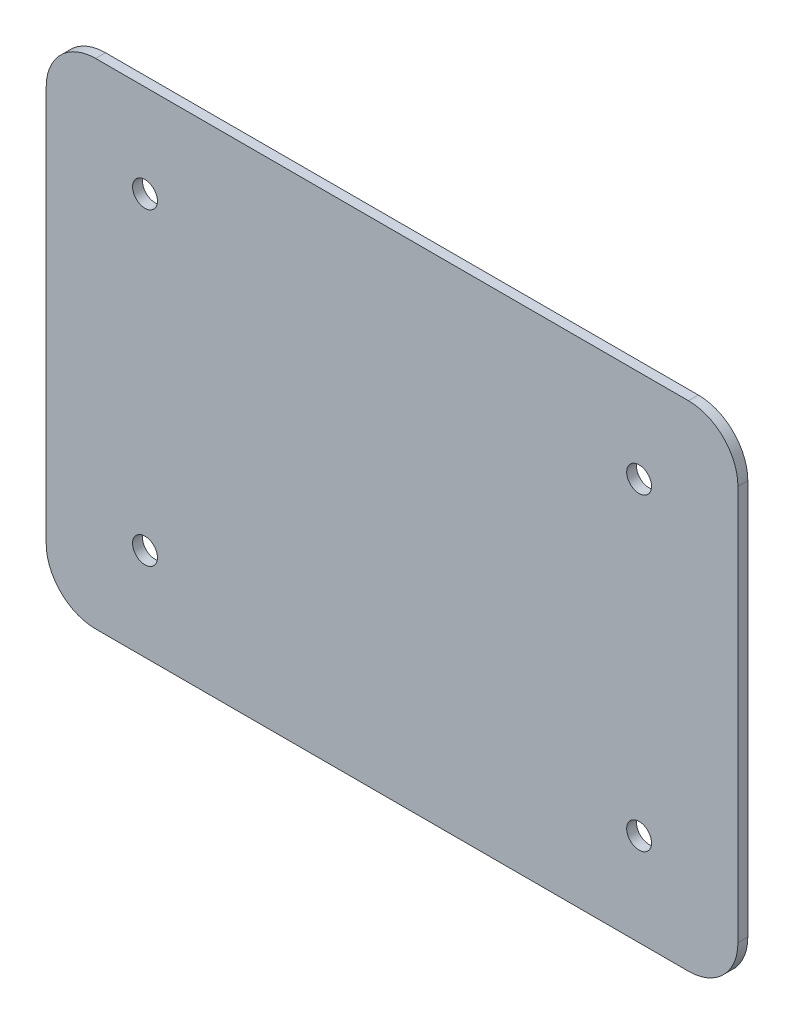
from build123d import *

# Parameters (mm, degrees)
SKETCH1_W                                  = 140
SKETCH1_H                                  = 100
BOSS_EXTRUDE1_DEPTH                        = 2
CUT_EXTRUDE2_REACH                         = 88.046
SKETCH2_R                                  = 2.515
FILLET1_R                                  = 10
MIRROR1_AT_THE_SECOND_PLANE_COPY_1_REACH   = 88.046
MIRROR1_AT_THE_SECOND_PLANE_COPY_1_SKETC_R = 2.515


with BuildPart() as part:
    # Sketch1 → Boss-Extrude1 (new body)
    with BuildSketch(Plane.XY):
        Rectangle(SKETCH1_W, SKETCH1_H)
    extrude(amount=BOSS_EXTRUDE1_DEPTH)

    # Sketch2 → Cut-Extrude2 (cut, up to next)
    with BuildSketch(Plane.XY, mode=Mode.PRIVATE) as cut_extrude2_sk1:
        with Locations((-50, 31.25)):
            Circle(SKETCH2_R)
    cut_extrude2_tool1 = extrude(cut_extrude2_sk1.sketch, amount=CUT_EXTRUDE2_REACH, mode=Mode.PRIVATE) & part.part
    cut_extrude2 = cut_extrude2_tool1.solids().sort_by_distance((-50, 31.25, 0))[0]
    add(cut_extrude2, mode=Mode.SUBTRACT)

    # Fillet1
    fillet1_edges = [part.edges().sort_by_distance(p)[0] for p in [
        (70, -50, 1),
        (70, 50, 1),
        (-70, -50, 1),
        (-70, 50, 1),
    ]]
    fillet(fillet1_edges, radius=FILLET1_R)

    # Mirror1: Cut-Extrude2 across plane
    add(cut_extrude2.mirror(Plane.ZX), mode=Mode.SUBTRACT)

    # Mirror1 at the second plane: Cut-Extrude2 across plane
    add(cut_extrude2.mirror(Plane(origin=(0, 0, 0), x_dir=(0, 0, 1), z_dir=(1, 0, 0))), mode=Mode.SUBTRACT)

    # Mirror1 at the second plane copy 1 sketc → Mirror1 at the second plane copy 1 (cut, up to next)
    with BuildSketch(Plane(origin=(0, 0, 0), x_dir=(-1, 0, 0), z_dir=(0, 0, 1)), mode=Mode.PRIVATE) as mirror1_at_the_second_plane_copy_1_sk1:
        with Locations((-50, 31.25)):
            Circle(MIRROR1_AT_THE_SECOND_PLANE_COPY_1_SKETC_R)
    mirror1_at_the_second_plane_copy_1_tool1 = extrude(mirror1_at_the_second_plane_copy_1_sk1.sketch, amount=MIRROR1_AT_THE_SECOND_PLANE_COPY_1_REACH, mode=Mode.PRIVATE) & part.part
    add(mirror1_at_the_second_plane_copy_1_tool1.solids().sort_by_distance((50, -31.25, 0))[0], mode=Mode.SUBTRACT)


solid = part.part
